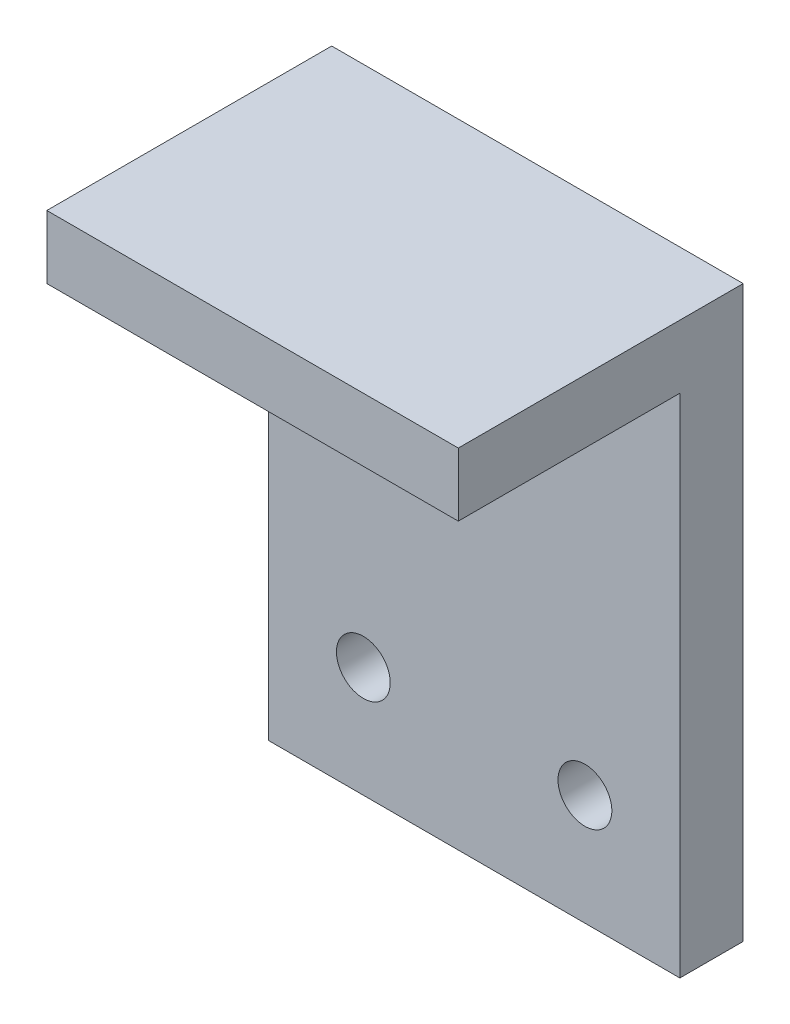
from build123d import *

# Parameters (mm, degrees)
SKETCH_3_W          = 26
SKETCH_3_H          = 36
EXTRUDE_1_DEPTH     = 4
CUT_EXTRUDE_1_REACH = 24.561
SKETCH_4_R          = 1.7
SKETCH_5_W          = 26
SKETCH_5_H          = 4
EXTRUDE_2_DEPTH     = 14


with BuildPart() as part:
    # Эскиз3 → Бобышка-Вытянуть1 (new body)
    with BuildSketch(Plane.XY):
        Rectangle(SKETCH_3_W, SKETCH_3_H)
    extrude(amount=EXTRUDE_1_DEPTH)

    # Эскиз4 → Вырез-Вытянуть1 (cut, up to next)
    with BuildSketch(Plane.XY.offset(4), mode=Mode.PRIVATE) as cut_extrude_1_sk1:
        with Locations((-7, -11)):
            Circle(SKETCH_4_R)
    cut_extrude_1_tool1 = extrude(cut_extrude_1_sk1.sketch, amount=-CUT_EXTRUDE_1_REACH, mode=Mode.PRIVATE) & part.part
    # Эскиз4 → Вырез-Вытянуть1 (cut, up to next)
    with BuildSketch(Plane.XY.offset(4), mode=Mode.PRIVATE) as cut_extrude_1_sk2:
        with Locations(Location((7, -11, 0), (0, 0, 180))):
            Circle(SKETCH_4_R)
    cut_extrude_1_tool2 = extrude(cut_extrude_1_sk2.sketch, amount=-CUT_EXTRUDE_1_REACH, mode=Mode.PRIVATE) & part.part
    add(cut_extrude_1_tool1.solids().sort_by_distance((-7, -11, 4))[0], mode=Mode.SUBTRACT)
    add(cut_extrude_1_tool2.solids().sort_by_distance((7, -11, 4))[0], mode=Mode.SUBTRACT)

    # Эскиз5 → Бобышка-Вытянуть2 (add)
    with BuildSketch(Plane.XY.offset(4)):
        with Locations((0, 16)):
            Rectangle(SKETCH_5_W, SKETCH_5_H)
    extrude(amount=EXTRUDE_2_DEPTH)


solid = part.part
